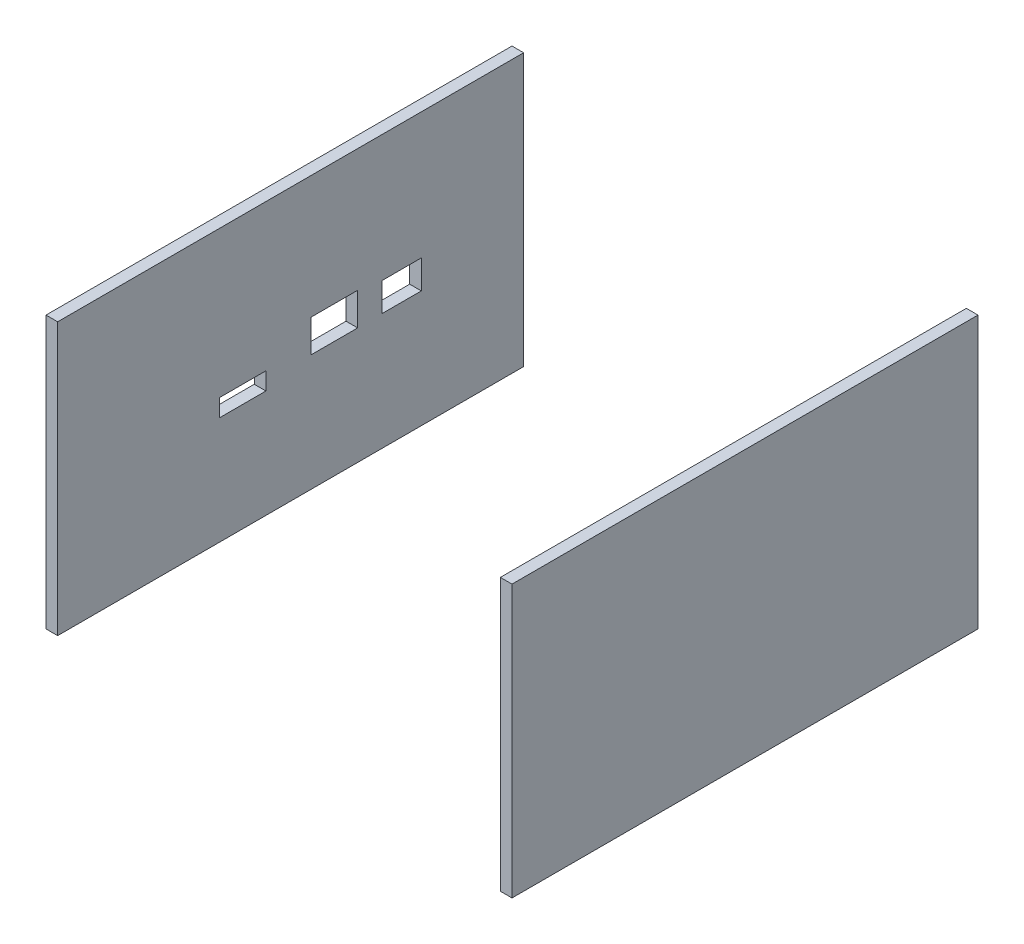
from build123d import *

# Parameters (mm, degrees)
SKETCH1_W           = 140
SKETCH1_H           = 160
BOSS_EXTRUDE1_DEPTH = 3
SKETCH2_W           = 120
SKETCH2_H           = 120
SKETCH2_W_2         = 114
SKETCH2_H_2         = 114
BOSS_EXTRUDE2_DEPTH = 70
SKETCH4_W           = 120
SKETCH4_H           = 120
BOSS_EXTRUDE4_DEPTH = 3
SKETCH5_R           = 2.1
SKETCH5_W           = 39.9
SKETCH5_H           = 19.71
CUT_EXTRUDE2_DEPTH  = 3
SKETCH6_W           = 18.298163042
SKETCH6_H           = 17.309993256
CUT_EXTRUDE3_DEPTH  = 3
CUT_EXTRUDE8_DEPTH  = 5
SKETCH15_W          = 259.021634325
SKETCH15_H          = 180.269434884
BOSS_EXTRUDE5_DEPTH = 3
SKETCH18_R          = 1.6
CUT_EXTRUDE9_DEPTH  = 10
SKETCH19_W          = 12
SKETCH19_H          = 4.5
SKETCH19_H_2        = 8.4
SKETCH19_W_2        = 10.084057066
SKETCH19_H_3        = 7.362028533
CUT_EXTRUDE11_DEPTH = 5
SKETCH20_W          = 263.921538054
SKETCH20_H          = 19.630552878
SKETCH20_W_2        = 120
SKETCH20_H_2        = 3
CUT_EXTRUDE12_DEPTH = 233.259150239
SKETCH21_W          = 259.021634325
SKETCH21_H          = 40.269434884
CUT_EXTRUDE13_DEPTH = 209.619923406
SKETCH22_W          = 114
SKETCH22_H          = 125.782417664
CUT_EXTRUDE14_DEPTH = 111


with BuildPart() as part:
    # Sketch1 → Boss-Extrude1 (new body)
    with BuildSketch(Plane(origin=(0, 0, 0), x_dir=(1, 0, 0), z_dir=(0, 1, 0))):
        Rectangle(SKETCH1_W, SKETCH1_H)
    extrude(amount=BOSS_EXTRUDE1_DEPTH)

    # Sketch2 → Boss-Extrude2 (add)
    with BuildSketch(Plane(origin=(0, 3, 0), x_dir=(1, 0, 0), z_dir=(0, 1, 0))):
        Rectangle(SKETCH2_W, SKETCH2_H)
        Rectangle(SKETCH2_W_2, SKETCH2_H_2, mode=Mode.SUBTRACT)
    extrude(amount=BOSS_EXTRUDE2_DEPTH)

    # Sketch4 → Boss-Extrude4 (add)
    with BuildSketch(Plane(origin=(0, 73, 0), x_dir=(1, 0, 0), z_dir=(0, 1, 0))):
        Rectangle(SKETCH4_W, SKETCH4_H)
    extrude(amount=BOSS_EXTRUDE4_DEPTH)

    # Sketch5 → Cut-Extrude2 (cut)
    with BuildSketch(Plane(origin=(0, 76, 0), x_dir=(1, 0, 0), z_dir=(0, 1, 0))):
        with Locations(Location((34.39, -4.925, 0), (0, 0, 270))):
            Circle(SKETCH5_R)
        with Locations(Location((34.39, 4.925, 0), (0, 0, 270))):
            Circle(SKETCH5_R)
        with Locations(Location((-15.03, -4.925, 0), (0, 0, 270))):
            Circle(SKETCH5_R)
        with Locations(Location((-15.03, 4.925, 0), (0, 0, 270))):
            Circle(SKETCH5_R)
        with Locations((9.68, 0)):
            Rectangle(SKETCH5_W, SKETCH5_H)
    extrude(amount=-CUT_EXTRUDE2_DEPTH, mode=Mode.SUBTRACT)

    # Sketch6 → Cut-Extrude3 (cut)
    with BuildSketch(Plane(origin=(0, 76, 0), x_dir=(1, 0, 0), z_dir=(0, 1, 0))):
        Rectangle(SKETCH6_W, SKETCH6_H)
    extrude(amount=-CUT_EXTRUDE3_DEPTH, mode=Mode.SUBTRACT)

    # Sketch13 → Cut-Extrude8 (cut)
    with BuildSketch(Plane(origin=(0, 76, 0), x_dir=(1, 0, 0), z_dir=(0, 1, 0))):
        with BuildLine():
            ThreePointArc((-3.792582359, 49.728765052), (-53.491503795, -1.722579942), (-0.349490011, -49.609426409))
            ThreePointArc((-0.349490011, -49.609426409), (5.82592347, -42.51288634), (-1.270616599, -36.337472859))
            ThreePointArc((-1.270616599, -36.337472859), (-40.195607742, -1.261740085), (-3.792582359, 36.42488497))
            ThreePointArc((-3.792582359, 36.42488497), (2.859357682, 43.076825011), (-3.792582359, 49.728765052))
        make_face()
    extrude(amount=-CUT_EXTRUDE8_DEPTH, mode=Mode.SUBTRACT)

    # Sketch15 → Boss-Extrude5 (add)
    with BuildSketch(Plane(origin=(0, 3, 0), x_dir=(1, 0, 0), z_dir=(0, 1, 0))):
        with Locations((-39.510817163, -10.134717442)):
            Rectangle(SKETCH15_W, SKETCH15_H)
    extrude(amount=-BOSS_EXTRUDE5_DEPTH)

    # Sketch18 → Cut-Extrude9 (cut)
    with BuildSketch(Plane(origin=(0, 3, 0), x_dir=(1, 0, 0), z_dir=(0, 1, 0))):
        with Locations(Location((-55.452, -27.227420358, 0), (0, 0, 194.647469308))):
            Circle(SKETCH18_R)
        with Locations(Location((-55.452, 32.208579642, 0), (0, 0, 194.647469308))):
            Circle(SKETCH18_R)
        with Locations(Location((4.746, 32.208579642, 0), (0, 0, 270))):
            Circle(SKETCH18_R)
        with Locations(Location((4.746, -27.227420358, 0), (0, 0, 270))):
            Circle(SKETCH18_R)
    extrude(amount=-CUT_EXTRUDE9_DEPTH, mode=Mode.SUBTRACT)

    # Sketch19 → Cut-Extrude11 (cut)
    with BuildSketch(Plane.ZY.offset(60)):
        with Locations((12.367420358, 33)):
            Rectangle(SKETCH19_W, SKETCH19_H)
        with Locations((-11.259414931, 37.2)):
            Rectangle(SKETCH19_W, SKETCH19_H_2)
        with Locations((-28.606781654, 36.742945388)):
            Rectangle(SKETCH19_W_2, SKETCH19_H_3)
    extrude(amount=-CUT_EXTRUDE11_DEPTH, mode=Mode.SUBTRACT)

    # Sketch20 → Cut-Extrude12 (cut, through all)
    with BuildSketch(Plane.XY.offset(60)):
        with Locations((-37.060865298, -6.815276439)):
            Rectangle(SKETCH20_W, SKETCH20_H)
        with Locations((0, 74.5)):
            Rectangle(SKETCH20_W_2, SKETCH20_H_2)
    extrude(amount=-CUT_EXTRUDE12_DEPTH, mode=Mode.SUBTRACT)


with BuildPart() as cut_extrude12_piece_1:
    # of the separate pieces the step leaves, piece 1, a body of its own (cut_extrude12_pieces)
    add(part.part.solids().sort_by_distance((60, 73, 60))[0])

    # Sketch22 → Cut-Extrude14 (cut, through all)
    with BuildSketch(Plane(origin=(0, 73, 0), x_dir=(1, 0, 0), z_dir=(0, 1, 0))):
        with Locations((0, -2.891208832)):
            Rectangle(SKETCH22_W, SKETCH22_H)
    extrude(amount=-CUT_EXTRUDE14_DEPTH, mode=Mode.SUBTRACT)


with BuildPart() as cut_extrude12_piece_2:
    # of the separate pieces the step leaves, piece 2, a body of its own (cut_extrude12_pieces)
    add(part.part.solids().sort_by_distance((90, 0, 60))[0])

    # Sketch21 → Cut-Extrude13 (cut, through all)
    with BuildSketch(Plane(origin=(0, 3, 0), x_dir=(1, 0, 0), z_dir=(0, 1, 0))):
        with Locations((-39.510817163, -80.134717442)):
            Rectangle(SKETCH21_W, SKETCH21_H)
    extrude(amount=-CUT_EXTRUDE13_DEPTH, mode=Mode.SUBTRACT)


with BuildPart() as cut_extrude14_piece_1:
    # of the separate pieces the step leaves, piece 1, a body of its own (cut_extrude14_pieces)
    add(cut_extrude12_piece_1.part.solids().sort_by_distance((60, 73, 60))[0])


with BuildPart() as cut_extrude14_piece_2:
    # of the separate pieces the step leaves, piece 2, a body of its own (cut_extrude14_pieces)
    add(cut_extrude12_piece_1.part.solids().sort_by_distance((-57, 3, 60))[0])


solid = Compound([cut_extrude14_piece_1.part, cut_extrude14_piece_2.part])
